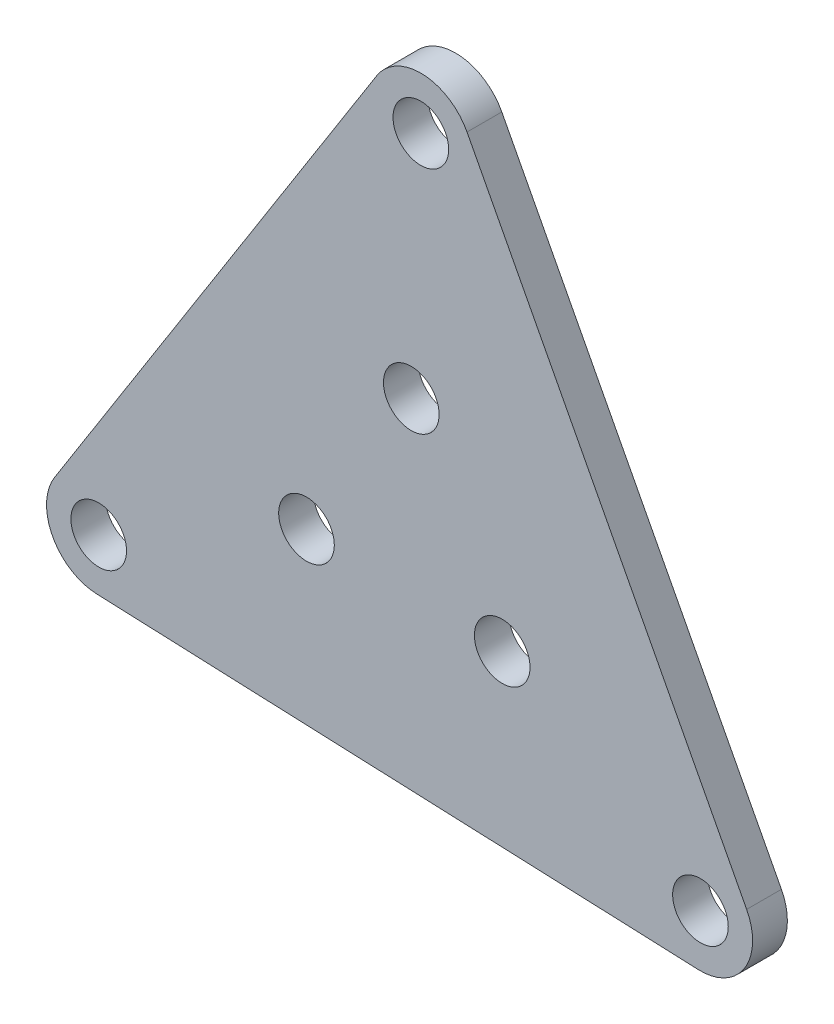
from build123d import *

# Parameters (mm, degrees)
SKETCH1_R           = 1.6
BOSS_EXTRUDE1_DEPTH = 2


with BuildPart() as part:
    # Sketch1 → Boss-Extrude1 (new body)
    with BuildSketch(Plane.XY):
        with BuildLine():
            Line((-17.835815571, -12.283471941), (16.776433238, -13.694936576))
            ThreePointArc((16.776433238, -13.694936576), (19.43347011, -12.302042086), (19.555706533, -9.304533411))
            Line((19.555706533, -9.304533411), (3.471946359, 21.376285657))
            ThreePointArc((3.471946359, 21.376285657), (0.93714591, 22.980899842), (-1.719890963, 21.588005352))
            Line((-1.719890963, 21.588005352), (-20.248379597, -7.681349081))
            ThreePointArc((-20.248379597, -7.681349081), (-20.37061602, -10.678857756), (-17.835815571, -12.283471941))
        make_face()
        with Locations((16.898669661, -10.697427901)):
            Circle(SKETCH1_R, mode=Mode.SUBTRACT)
        with Locations((-17.713579148, -9.285963266)):
            Circle(SKETCH1_R, mode=Mode.SUBTRACT)
        with Locations((0.814909487, 19.983391167)):
            Circle(SKETCH1_R, mode=Mode.SUBTRACT)
        with Locations((0.265065705, 6.5)):
            Circle(SKETCH1_R, mode=Mode.SUBTRACT)
        with Locations((-5.761697977, -3.020446366)):
            Circle(SKETCH1_R, mode=Mode.SUBTRACT)
        with Locations((5.496632272, -3.479553634)):
            Circle(SKETCH1_R, mode=Mode.SUBTRACT)
    extrude(amount=BOSS_EXTRUDE1_DEPTH)


solid = part.part
